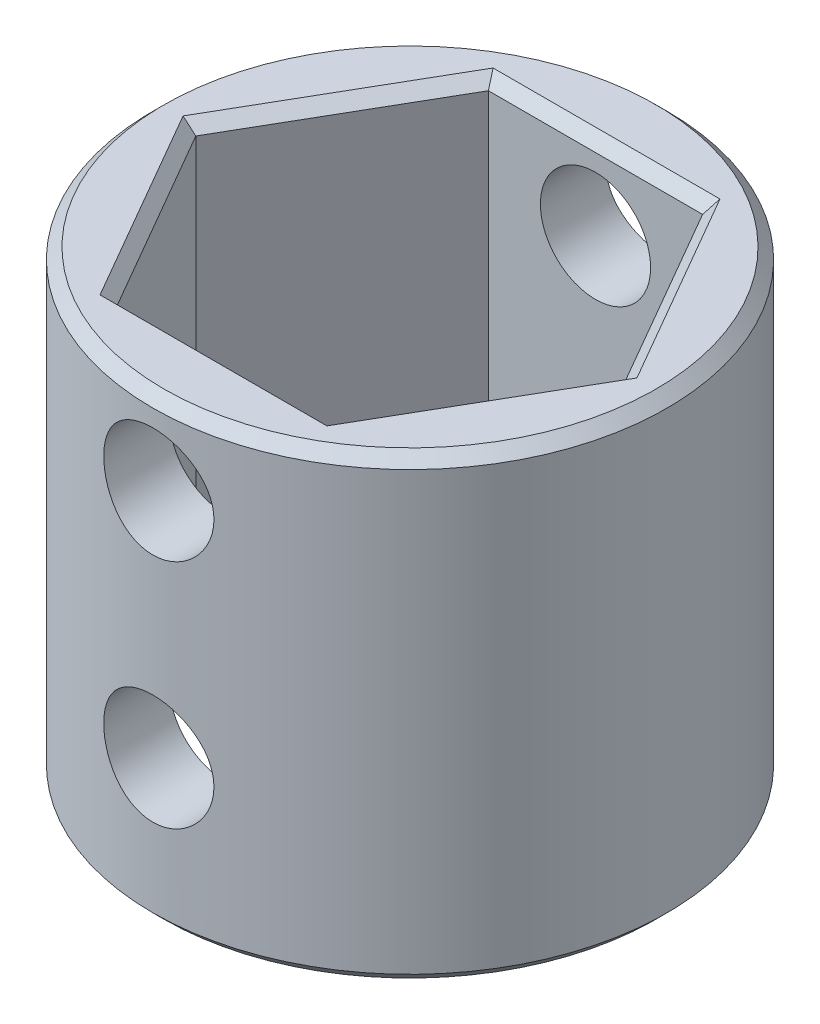
from build123d import *

# Parameters (mm, degrees)
SKETCH1_R               = 8.89
BOSS_EXTRUDE1_DEPTH     = 7.9375
CHAMFER1_SIZE           = 0.381
CUT_EXTRUDE1_DEPTH      = 15.868359232
CUT_EXTRUDE1_DEPTH_BACK = 15.868359232
SKETCH3_R               = 1.905


with BuildPart() as part:
    # Sketch1 → Boss-Extrude1 (new, symmetric)
    with BuildSketch(Plane(origin=(0, 0, 0), x_dir=(1, 0, 0), z_dir=(0, 1, 0))):
        with Locations(Location((0, 0, 0), (0, 0, 270))):
            Circle(SKETCH1_R)
        Polygon((3.702835951, -6.4135), (7.405671903, 0), (3.702835951, 6.4135), (-3.702835951, 6.4135), (-7.405671903, 0), (-3.702835951, -6.4135), align=None, mode=Mode.SUBTRACT)
    extrude(amount=BOSS_EXTRUDE1_DEPTH, both=True)

    # Chamfer1
    chamfer1_edges = [part.edges().sort_by_distance(p)[0] for p in [
        (5.554253927, -7.9375, -3.20675),
        (0, -7.9375, -6.4135),
        (-5.554253927, -7.9375, -3.20675),
        (-5.554253927, -7.9375, 3.20675),
        (0, 7.9375, 6.4135),
        (5.554253927, 7.9375, 3.20675),
        (5.554253927, 7.9375, -3.20675),
        (0, 7.9375, -6.4135),
        (-5.554253927, 7.9375, -3.20675),
        (-5.554253927, 7.9375, 3.20675),
        (0, -7.9375, -8.89),
        (0, 7.9375, -8.89),
        (0, -7.9375, 6.4135),
        (5.554253927, -7.9375, 3.20675),
    ]]
    chamfer(chamfer1_edges, length=CHAMFER1_SIZE)

    # Sketch3 → Cut-Extrude1 (cut, two sides: drawn at the far end of the back side and taken through both)
    with BuildSketch(Plane.XY.offset(-CUT_EXTRUDE1_DEPTH_BACK)):
        with Locations((0, -2.9375)):
            Circle(SKETCH3_R)
        with Locations((0, 5.0625)):
            Circle(SKETCH3_R)
    extrude(amount=CUT_EXTRUDE1_DEPTH + CUT_EXTRUDE1_DEPTH_BACK, mode=Mode.SUBTRACT)


solid = part.part
